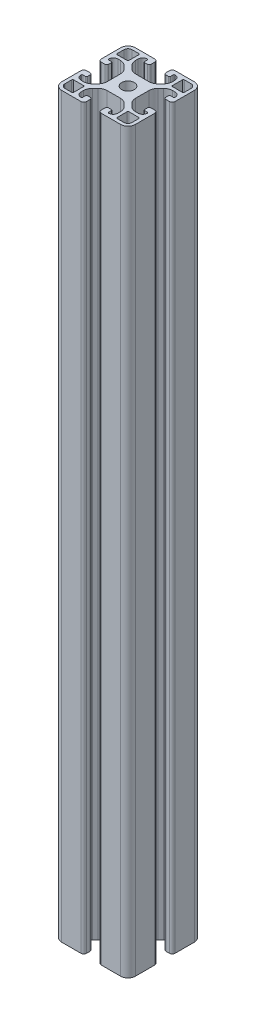
from build123d import *

# Parameters (mm, degrees)
SZKIC2_R                    = 3.4
DODANIE_WYCI_GNI_CIE2_DEPTH = 200


with BuildPart() as part:
    # Szkic2 → Dodanie-wyciągnięcie2 (new, symmetric)
    with BuildSketch(Plane(origin=(0, 0, 0), x_dir=(1, 0, 0), z_dir=(0, 1, 0))):
        with BuildLine():
            Line((-16, 20), (-5.499994708, 20))
            ThreePointArc((-5.499994708, 20), (-4.439334536, 19.560660172), (-3.999994708, 18.5))
            Line((-3.999994708, 18.5), (-3.999994708, 16.5))
            ThreePointArc((-3.999994708, 16.5), (-4.292887927, 15.792893219), (-4.999994708, 15.5))
            Line((-4.999994708, 15.5), (-6.499994708, 15.5))
            ThreePointArc((-6.499994708, 15.5), (-6.853548099, 15.646446609), (-6.999994708, 16))
            Line((-6.999994708, 16), (-6.999994708, 17.5))
            ThreePointArc((-6.999994708, 17.5), (-7.14644085, 17.853552923), (-7.499993385, 18))
            ThreePointArc((-7.499993385, 18), (-9.267764614, 17.267769292), (-10, 15.5))
            Line((-10, 15.5), (-10, 14.171067812))
            ThreePointArc((-10, 14.171067812), (-9.619397663, 12.25765065), (-8.535533906, 10.635533906))
            Line((-8.535533906, 10.635533906), (-7.114466094, 9.214466094))
            ThreePointArc((-7.114466094, 9.214466094), (-5.49234935, 8.130602337), (-3.578932188, 7.75))
            Line((-3.578932188, 7.75), (3.578932188, 7.75))
            ThreePointArc((3.578932188, 7.75), (5.49234935, 8.130602337), (7.114466094, 9.214466094))
            Line((7.114466094, 9.214466094), (8.535533906, 10.635533906))
            ThreePointArc((8.535533906, 10.635533906), (9.619397663, 12.25765065), (10, 14.171067812))
            Line((10, 14.171067812), (10, 15.5))
            ThreePointArc((10, 15.5), (9.267769292, 17.267764614), (7.500006615, 18))
            ThreePointArc((7.500006615, 18), (7.146452369, 17.853553858), (7.000005292, 17.5))
            Line((7.000005292, 17.5), (7.000005292, 16))
            ThreePointArc((7.000005292, 16), (6.853558682, 15.646446609), (6.500005292, 15.5))
            Line((6.500005292, 15.5), (5.000005292, 15.5))
            ThreePointArc((5.000005292, 15.5), (4.292898511, 15.792893219), (4.000005292, 16.5))
            Line((4.000005292, 16.5), (4.000005292, 18.5))
            ThreePointArc((4.000005292, 18.5), (4.43934512, 19.560660172), (5.500005292, 20))
            Line((5.500005292, 20), (16, 20))
            ThreePointArc((16, 20), (18.828427125, 18.828427125), (20, 16))
            Line((20, 16), (20, 5.499994708))
            ThreePointArc((20, 5.499994708), (19.560660172, 4.439334536), (18.5, 3.999994708))
            Line((18.5, 3.999994708), (16.5, 3.999994708))
            ThreePointArc((16.5, 3.999994708), (15.792893219, 4.292887927), (15.5, 4.999994708))
            Line((15.5, 4.999994708), (15.5, 6.499994708))
            ThreePointArc((15.5, 6.499994708), (15.646446609, 6.853548099), (16, 6.999994708))
            Line((16, 6.999994708), (17.5, 6.999994708))
            ThreePointArc((17.5, 6.999994708), (17.853552923, 7.14644085), (18, 7.499993385))
            ThreePointArc((18, 7.499993385), (17.267769292, 9.267764614), (15.5, 10))
            Line((15.5, 10), (14.171067812, 10))
            ThreePointArc((14.171067812, 10), (12.25765065, 9.619397663), (10.635533906, 8.535533906))
            Line((10.635533906, 8.535533906), (9.214466094, 7.114466094))
            ThreePointArc((9.214466094, 7.114466094), (8.130602337, 5.49234935), (7.75, 3.578932188))
            Line((7.75, 3.578932188), (7.75, -3.578932188))
            ThreePointArc((7.75, -3.578932188), (8.130602337, -5.49234935), (9.214466094, -7.114466094))
            Line((9.214466094, -7.114466094), (10.635533906, -8.535533906))
            ThreePointArc((10.635533906, -8.535533906), (12.25765065, -9.619397663), (14.171067812, -10))
            Line((14.171067812, -10), (15.5, -10))
            ThreePointArc((15.5, -10), (17.267764614, -9.267769292), (18, -7.500006615))
            ThreePointArc((18, -7.500006615), (17.853553858, -7.146452369), (17.5, -7.000005292))
            Line((17.5, -7.000005292), (16, -7.000005292))
            ThreePointArc((16, -7.000005292), (15.646446609, -6.853558682), (15.5, -6.500005292))
            Line((15.5, -6.500005292), (15.5, -5.000005292))
            ThreePointArc((15.5, -5.000005292), (15.792893219, -4.292898511), (16.5, -4.000005292))
            Line((16.5, -4.000005292), (18.5, -4.000005292))
            ThreePointArc((18.5, -4.000005292), (19.560660172, -4.43934512), (20, -5.500005292))
            Line((20, -5.500005292), (20, -16))
            ThreePointArc((20, -16), (18.828427125, -18.828427125), (16, -20))
            Line((16, -20), (5.499994708, -20))
            ThreePointArc((5.499994708, -20), (4.439334536, -19.560660172), (3.999994708, -18.5))
            Line((3.999994708, -18.5), (3.999994708, -16.5))
            ThreePointArc((3.999994708, -16.5), (4.292887927, -15.792893219), (4.999994708, -15.5))
            Line((4.999994708, -15.5), (6.499994708, -15.5))
            ThreePointArc((6.499994708, -15.5), (6.853548099, -15.646446609), (6.999994708, -16))
            Line((6.999994708, -16), (6.999994708, -17.5))
            ThreePointArc((6.999994708, -17.5), (7.14644085, -17.853552923), (7.499993385, -18))
            ThreePointArc((7.499993385, -18), (9.267764614, -17.267769292), (10, -15.5))
            Line((10, -15.5), (10, -14.171067812))
            ThreePointArc((10, -14.171067812), (9.619397663, -12.25765065), (8.535533906, -10.635533906))
            Line((8.535533906, -10.635533906), (7.114466094, -9.214466094))
            ThreePointArc((7.114466094, -9.214466094), (5.49234935, -8.130602337), (3.578932188, -7.75))
            Line((3.578932188, -7.75), (-3.578932188, -7.75))
            ThreePointArc((-3.578932188, -7.75), (-5.49234935, -8.130602337), (-7.114466094, -9.214466094))
            Line((-7.114466094, -9.214466094), (-8.535533906, -10.635533906))
            ThreePointArc((-8.535533906, -10.635533906), (-9.619397663, -12.25765065), (-10, -14.171067812))
            Line((-10, -14.171067812), (-10, -15.5))
            ThreePointArc((-10, -15.5), (-9.267769292, -17.267764614), (-7.500006615, -18))
            ThreePointArc((-7.500006615, -18), (-7.146452369, -17.853553858), (-7.000005292, -17.5))
            Line((-7.000005292, -17.5), (-7.000005292, -16))
            ThreePointArc((-7.000005292, -16), (-6.853558682, -15.646446609), (-6.500005292, -15.5))
            Line((-6.500005292, -15.5), (-5.000005292, -15.5))
            ThreePointArc((-5.000005292, -15.5), (-4.292898511, -15.792893219), (-4.000005292, -16.5))
            Line((-4.000005292, -16.5), (-4.000005292, -18.5))
            ThreePointArc((-4.000005292, -18.5), (-4.43934512, -19.560660172), (-5.500005292, -20))
            Line((-5.500005292, -20), (-16, -20))
            ThreePointArc((-16, -20), (-18.828427125, -18.828427125), (-20, -16))
            Line((-20, -16), (-20, -5.499994708))
            ThreePointArc((-20, -5.499994708), (-19.560660172, -4.439334536), (-18.5, -3.999994708))
            Line((-18.5, -3.999994708), (-16.5, -3.999994708))
            ThreePointArc((-16.5, -3.999994708), (-15.792893219, -4.292887927), (-15.5, -4.999994708))
            Line((-15.5, -4.999994708), (-15.5, -6.499994708))
            ThreePointArc((-15.5, -6.499994708), (-15.646446609, -6.853548099), (-16, -6.999994708))
            Line((-16, -6.999994708), (-17.5, -6.999994708))
            ThreePointArc((-17.5, -6.999994708), (-17.853552923, -7.14644085), (-18, -7.499993385))
            ThreePointArc((-18, -7.499993385), (-17.267769292, -9.267764614), (-15.5, -10))
            Line((-15.5, -10), (-14.171067812, -10))
            ThreePointArc((-14.171067812, -10), (-12.25765065, -9.619397663), (-10.635533906, -8.535533906))
            Line((-10.635533906, -8.535533906), (-9.214466094, -7.114466094))
            ThreePointArc((-9.214466094, -7.114466094), (-8.130602337, -5.49234935), (-7.75, -3.578932188))
            Line((-7.75, -3.578932188), (-7.75, 3.578932188))
            ThreePointArc((-7.75, 3.578932188), (-8.130602337, 5.49234935), (-9.214466094, 7.114466094))
            Line((-9.214466094, 7.114466094), (-10.635533906, 8.535533906))
            ThreePointArc((-10.635533906, 8.535533906), (-12.25765065, 9.619397663), (-14.171067812, 10))
            Line((-14.171067812, 10), (-15.5, 10))
            ThreePointArc((-15.5, 10), (-17.267764614, 9.267769292), (-18, 7.500006615))
            ThreePointArc((-18, 7.500006615), (-17.853553858, 7.146452369), (-17.5, 7.000005292))
            Line((-17.5, 7.000005292), (-16, 7.000005292))
            ThreePointArc((-16, 7.000005292), (-15.646446609, 6.853558682), (-15.5, 6.500005292))
            Line((-15.5, 6.500005292), (-15.5, 5.000005292))
            ThreePointArc((-15.5, 5.000005292), (-15.792893219, 4.292898511), (-16.5, 4.000005292))
            Line((-16.5, 4.000005292), (-18.5, 4.000005292))
            ThreePointArc((-18.5, 4.000005292), (-19.560660172, 4.43934512), (-20, 5.500005292))
            Line((-20, 5.500005292), (-20, 16))
            ThreePointArc((-20, 16), (-18.828427125, 18.828427125), (-16, 20))
        make_face()
        Circle(SZKIC2_R, mode=Mode.SUBTRACT)
        with BuildLine():
            Line((-11.8, -17.7), (-11.8, -12.3))
            ThreePointArc((-11.8, -12.3), (-11.946446609, -11.946446609), (-12.3, -11.8))
            Line((-12.3, -11.8), (-17.7, -11.8))
            ThreePointArc((-17.7, -11.8), (-18.053553391, -11.946446609), (-18.2, -12.3))
            Line((-18.2, -12.3), (-18.2, -16))
            ThreePointArc((-18.2, -16), (-17.555634919, -17.555634919), (-16, -18.2))
            Line((-16, -18.2), (-12.3, -18.2))
            ThreePointArc((-12.3, -18.2), (-11.946446609, -18.053553391), (-11.8, -17.7))
        make_face(mode=Mode.SUBTRACT)
        with BuildLine():
            Line((17.7, -11.8), (12.3, -11.8))
            ThreePointArc((12.3, -11.8), (11.946446609, -11.946446609), (11.8, -12.3))
            Line((11.8, -12.3), (11.8, -17.7))
            ThreePointArc((11.8, -17.7), (11.946446609, -18.053553391), (12.3, -18.2))
            Line((12.3, -18.2), (16, -18.2))
            ThreePointArc((16, -18.2), (17.555634919, -17.555634919), (18.2, -16))
            Line((18.2, -16), (18.2, -12.3))
            ThreePointArc((18.2, -12.3), (18.053553391, -11.946446609), (17.7, -11.8))
        make_face(mode=Mode.SUBTRACT)
        with BuildLine():
            Line((11.8, 17.7), (11.8, 12.3))
            ThreePointArc((11.8, 12.3), (11.946446609, 11.946446609), (12.3, 11.8))
            Line((12.3, 11.8), (17.7, 11.8))
            ThreePointArc((17.7, 11.8), (18.053553391, 11.946446609), (18.2, 12.3))
            Line((18.2, 12.3), (18.2, 16))
            ThreePointArc((18.2, 16), (17.555634919, 17.555634919), (16, 18.2))
            Line((16, 18.2), (12.3, 18.2))
            ThreePointArc((12.3, 18.2), (11.946446609, 18.053553391), (11.8, 17.7))
        make_face(mode=Mode.SUBTRACT)
        with BuildLine():
            Line((-11.8, 12.3), (-11.8, 17.7))
            ThreePointArc((-11.8, 17.7), (-11.946446609, 18.053553391), (-12.3, 18.2))
            Line((-12.3, 18.2), (-16, 18.2))
            ThreePointArc((-16, 18.2), (-17.555634919, 17.555634919), (-18.2, 16))
            Line((-18.2, 16), (-18.2, 12.3))
            ThreePointArc((-18.2, 12.3), (-18.053553391, 11.946446609), (-17.7, 11.8))
            Line((-17.7, 11.8), (-12.3, 11.8))
            ThreePointArc((-12.3, 11.8), (-11.946446609, 11.946446609), (-11.8, 12.3))
        make_face(mode=Mode.SUBTRACT)
    extrude(amount=DODANIE_WYCI_GNI_CIE2_DEPTH, both=True)


solid = part.part
